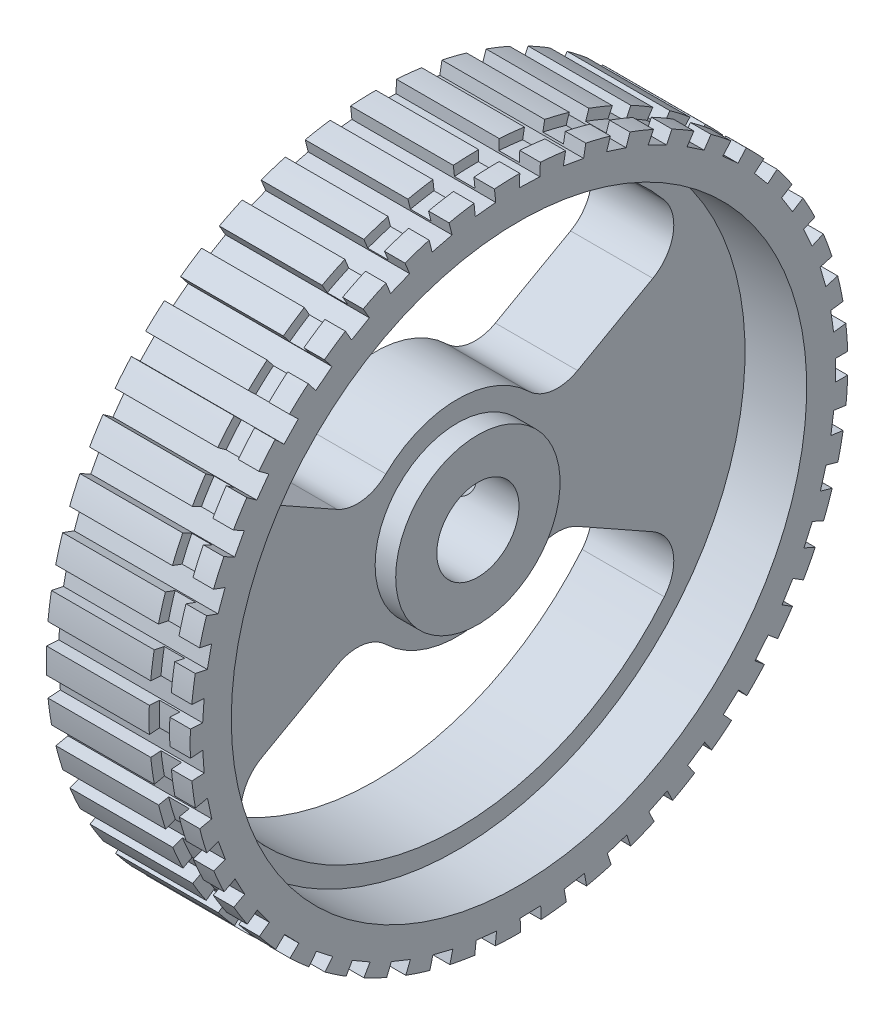
from build123d import *

# Parameters (mm, degrees)
CUT_EXTRUDE1_DEPTH       = 10
FILLET2_R                = 2
CIRPATTERN1_COUNT        = 2
FILLET2_OF_CIRPATTERN1_R = 2
SKETCH9_W                = 1
SKETCH9_H                = 0.5
CUT_EXTRUDE4_DEPTH       = 10
CIRPATTERN2_COUNT        = 45


with BuildPart() as part:
    # Sketch2 → Revolve1 (revolve)
    with BuildSketch(Plane(origin=(0, 0, 0), x_dir=(1, 0, 0), z_dir=(0, 1, 0)), mode=Mode.PRIVATE) as revolve1_sk:
        Polygon((0, 2), (0, 16), (7, 16), (7, 14), (4, 14), (4, 4), (5, 4), (5, 2), align=None)
    revolve(revolve1_sk.sketch.rotate(Axis((0, 0, 0), (1, 0, 0)), 180), axis=Axis((0, 0, 0), (1, 0, 0)))

    # Sketch6 → Cut-Revolve1 (revolve, cut)
    with BuildSketch(Plane(origin=(0, 0, 0), x_dir=(1, 0, 0), z_dir=(0, 1, 0))):
        Polygon((2, 0), (2.9, 0), (2.9, 11.5), (3.5, 11.5), (3.5, 16), (2, 16), align=None)
    revolve(axis=Axis((2, 0, 0), (0, 0, -1)), mode=Mode.SUBTRACT)

    # Sketch7 → Cut-Extrude1 (cut)
    with BuildSketch(Plane(origin=(4, 0, 0), x_dir=(0, 0, -1), z_dir=(1, 0, 0))):
        with BuildLine():
            Line((11.413607468, 6.406488483), (4.360234175, 2.447411136))
            ThreePointArc((4.360234175, 2.447411136), (0, 5.000146331), (-4.360234175, 2.447411136))
            Line((-4.360234175, 2.447411136), (-11.413607468, 6.406488483))
            ThreePointArc((-11.413607468, 6.406488483), (0, 13.088679464), (11.413607468, 6.406488483))
        make_face()
    cut_extrude1 = extrude(amount=-CUT_EXTRUDE1_DEPTH, mode=Mode.SUBTRACT)

    # Fillet2
    fillet2_edges = [part.edges().sort_by_distance(p)[0] for p in [
        (2, 6.406488483, 11.413607468),
        (2, 6.406488483, -11.413607468),
        (2, 2.447411136, -4.360234175),
        (2, 2.447411136, 4.360234175),
    ]]
    fillet(fillet2_edges, radius=FILLET2_R)

    # CirPattern1: Cut-Extrude1 ×2 about axis
    cirpattern1_axis = Axis((0, 0, 0), (1, 0, 0))
    for i in range(1, CIRPATTERN1_COUNT):
        add(cut_extrude1.rotate(cirpattern1_axis, i * 360 / CIRPATTERN1_COUNT), mode=Mode.SUBTRACT)

    # Fillet2 of CirPattern1
    fillet2_of_cirpattern1_edges = [part.edges().sort_by_distance(p)[0] for p in [
        (2, -6.406488483, -11.413607468),
        (2, -6.406488483, 11.413607468),
        (2, -2.447411136, 4.360234175),
        (2, -2.447411136, -4.360234175),
    ]]
    fillet(fillet2_of_cirpattern1_edges, radius=FILLET2_OF_CIRPATTERN1_R)

    # Sketch9 → Cut-Revolve2 (revolve, cut)
    with BuildSketch(Plane.XY, mode=Mode.PRIVATE) as cut_revolve2_sk:
        with Locations((5.5, 15.75)):
            Rectangle(SKETCH9_W, SKETCH9_H)
    revolve(cut_revolve2_sk.sketch.rotate(Axis((0, 0, 0), (-1, 0, 0)), 270), axis=Axis((0, 0, 0), (-1, 0, 0)), mode=Mode.SUBTRACT)

    # Sketch10 → Cut-Extrude4 (cut)
    with BuildSketch(Plane(origin=(7, 0, 0), x_dir=(0, 0, -1), z_dir=(1, 0, 0))):
        Polygon((15.392778183, 0.519327549), (16.100635314, 0.519327549), (16.100635314, -0.471938912), (16.100635314, -0.480672451), (15.392778183, -0.480672451), align=None)
    cut_extrude4 = extrude(amount=-CUT_EXTRUDE4_DEPTH, mode=Mode.SUBTRACT)

    # CirPattern2: Cut-Extrude4 ×45 about axis
    cirpattern2_axis = Axis((0, 0, 0), (1, 0, 0))
    for i in range(1, CIRPATTERN2_COUNT):
        add(cut_extrude4.rotate(cirpattern2_axis, i * 360 / CIRPATTERN2_COUNT), mode=Mode.SUBTRACT)


solid = part.part
